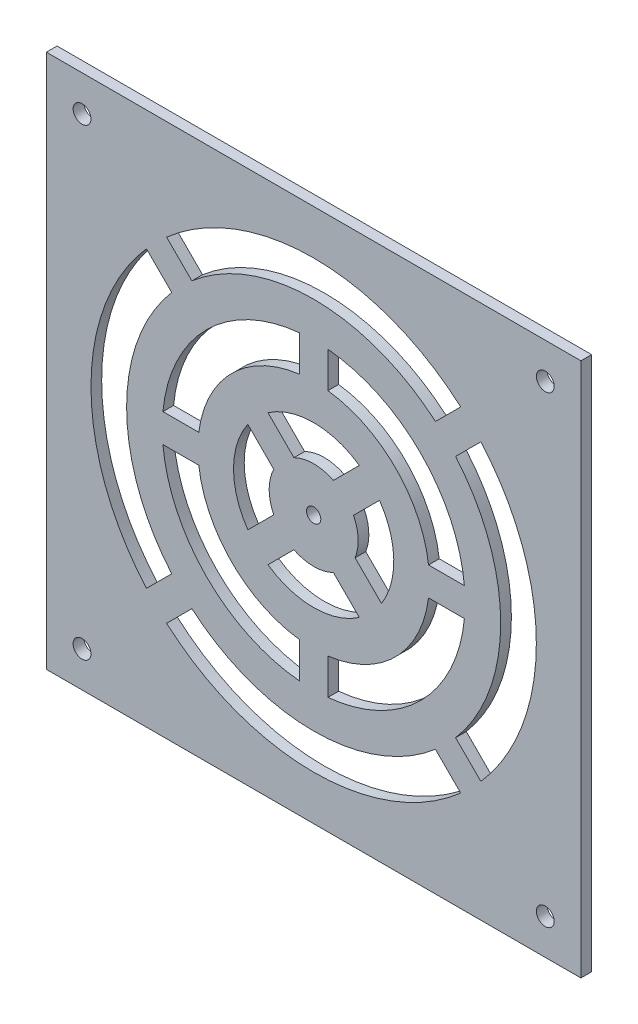
from build123d import *

# Parameters (mm, degrees)
SKETCH1_W           = 150
SKETCH1_H           = 150
BOSS_EXTRUDE1_DEPTH = 3
CUT_EXTRUDE1_DEPTH  = 264.0332057
SKETCH4_R           = 2.5
CUT_EXTRUDE2_DEPTH  = 3
SKETCH5_R           = 2
CUT_EXTRUDE3_DEPTH  = 10


with BuildPart() as part:
    # Sketch1 → Boss-Extrude1 (new body)
    with BuildSketch(Plane.XY):
        with Locations((146.896551724, 66.206896552)):
            Rectangle(SKETCH1_W, SKETCH1_H)
    extrude(amount=BOSS_EXTRUDE1_DEPTH)

    # Sketch2 → Cut-Extrude1 (cut, through all)
    with BuildSketch(Plane.XY.offset(3)):
        with BuildLine():
            ThreePointArc((188.163122783, 113.13032186), (146.896551724, 128.694797217), (105.629980666, 113.13032186))
            Line((105.629980666, 113.13032186), (112.718359737, 106.041942789))
            ThreePointArc((112.718359737, 106.041942789), (146.896551724, 118.694797217), (181.074743712, 106.041942789))
            Line((181.074743712, 106.041942789), (188.163122783, 113.13032186))
        make_face()
        with BuildLine():
            Line((107.061505487, 100.385088539), (99.973126416, 107.47346761))
            ThreePointArc((99.973126416, 107.47346761), (84.408651059, 66.206896552), (99.973126416, 24.940325493))
            Line((99.973126416, 24.940325493), (107.061505487, 32.028704564))
            ThreePointArc((107.061505487, 32.028704564), (94.408651059, 66.206896552), (107.061505487, 100.385088539))
        make_face()
        with BuildLine():
            ThreePointArc((209.384452389, 66.206896552), (205.363995952, 88.259009716), (193.819977032, 107.47346761))
            Line((193.819977032, 107.47346761), (186.731597961, 100.385088539))
            ThreePointArc((186.731597961, 100.385088539), (196.119705149, 84.429434333), (199.384452389, 66.206896552))
            ThreePointArc((199.384452389, 66.206896552), (196.119705149, 47.984358771), (186.731597961, 32.028704564))
            Line((186.731597961, 32.028704564), (193.819977032, 24.940325493))
            ThreePointArc((193.819977032, 24.940325493), (205.363995952, 44.154783387), (209.384452389, 66.206896552))
        make_face()
        with BuildLine():
            Line((112.718359737, 26.371850315), (105.629980666, 19.283471244))
            ThreePointArc((105.629980666, 19.283471244), (146.896551724, 3.718995886), (188.163122783, 19.283471244))
            Line((188.163122783, 19.283471244), (181.074743712, 26.371850315))
            ThreePointArc((181.074743712, 26.371850315), (146.896551724, 13.718995886), (112.718359737, 26.371850315))
        make_face()
        with BuildLine():
            ThreePointArc((150.896551724, 23.907703853), (176.940034403, 36.163413873), (189.195744423, 62.206896552))
            Line((189.195744423, 62.206896552), (179.137266506, 62.206896552))
            ThreePointArc((179.137266506, 62.206896552), (169.868966591, 43.234481685), (150.896551724, 33.96618177))
            Line((150.896551724, 33.96618177), (150.896551724, 23.907703853))
        make_face()
        with BuildLine():
            Line((114.655836942, 62.206896552), (104.597359026, 62.206896552))
            ThreePointArc((104.597359026, 62.206896552), (116.853069045, 36.163413873), (142.896551724, 23.907703853))
            Line((142.896551724, 23.907703853), (142.896551724, 33.96618177))
            ThreePointArc((142.896551724, 33.96618177), (123.924136857, 43.234481685), (114.655836942, 62.206896552))
        make_face()
        with BuildLine():
            Line((142.896551724, 98.447611333), (142.896551724, 108.50608925))
            ThreePointArc((142.896551724, 108.50608925), (116.853069045, 96.250379231), (104.597359026, 70.206896552))
            Line((104.597359026, 70.206896552), (114.655836942, 70.206896552))
            ThreePointArc((114.655836942, 70.206896552), (123.924136857, 89.179311419), (142.896551724, 98.447611333))
        make_face()
        with BuildLine():
            ThreePointArc((189.195744423, 70.206896552), (176.940034403, 96.250379231), (150.896551724, 108.50608925))
            Line((150.896551724, 108.50608925), (150.896551724, 98.447611333))
            ThreePointArc((150.896551724, 98.447611333), (169.868966591, 89.179311419), (179.137266506, 70.206896552))
            Line((179.137266506, 70.206896552), (189.195744423, 70.206896552))
        make_face()
        with BuildLine():
            Line((165.372753073, 79.026243651), (158.090015102, 71.74350568))
            ThreePointArc((158.090015102, 71.74350568), (159.056537781, 69.049853135), (159.384452389, 66.206896552))
            ThreePointArc((159.384452389, 66.206896552), (159.166880972, 63.885973637), (158.521748029, 61.645923641))
            Line((158.521748029, 61.645923641), (165.932760465, 54.234911206))
            ThreePointArc((165.932760465, 54.234911206), (168.504305512, 59.977076926), (169.384452389, 66.206896552))
            ThreePointArc((169.384452389, 66.206896552), (168.358106385, 72.923096956), (165.372753073, 79.026243651))
        make_face()
        with BuildLine():
            Line((134.077204625, 84.6830979), (141.359942596, 77.400359929))
            ThreePointArc((141.359942596, 77.400359929), (146.896551724, 78.694797217), (152.433160852, 77.400359929))
            Line((152.433160852, 77.400359929), (159.715898823, 84.6830979))
            ThreePointArc((159.715898823, 84.6830979), (146.896551724, 88.694797217), (134.077204625, 84.6830979))
        make_face()
        with BuildLine():
            ThreePointArc((135.703088346, 60.670287424), (134.408651059, 66.206896552), (135.703088346, 71.74350568))
            Line((135.703088346, 71.74350568), (128.420350375, 79.026243651))
            ThreePointArc((128.420350375, 79.026243651), (124.408651059, 66.206896552), (128.420350375, 53.387549452))
            Line((128.420350375, 53.387549452), (135.703088346, 60.670287424))
        make_face()
        with BuildLine():
            ThreePointArc((152.433160852, 55.013433174), (146.896551724, 53.718995886), (141.359942596, 55.013433174))
            Line((141.359942596, 55.013433174), (134.077204625, 47.730695203))
            ThreePointArc((134.077204625, 47.730695203), (146.896551724, 43.718995886), (159.715898823, 47.730695203))
            Line((159.715898823, 47.730695203), (152.433160852, 55.013433174))
        make_face()
    extrude(amount=-CUT_EXTRUDE1_DEPTH, mode=Mode.SUBTRACT)

    # Sketch4 → Cut-Extrude2 (cut)
    with BuildSketch(Plane.XY.offset(3)):
        with Locations((81.896551724, 131.206896552)):
            Circle(SKETCH4_R)
        with Locations((211.896551724, 131.206896552)):
            Circle(SKETCH4_R)
        with Locations((211.896551724, 1.206896552)):
            Circle(SKETCH4_R)
        with Locations((81.896551724, 1.206896552)):
            Circle(SKETCH4_R)
    extrude(amount=-CUT_EXTRUDE2_DEPTH, mode=Mode.SUBTRACT)

    # Sketch5 → Cut-Extrude3 (cut)
    with BuildSketch(Plane.XY.offset(3)):
        with Locations((146.896551724, 66.206896552)):
            Circle(SKETCH5_R)
    extrude(amount=-CUT_EXTRUDE3_DEPTH, mode=Mode.SUBTRACT)


solid = part.part
